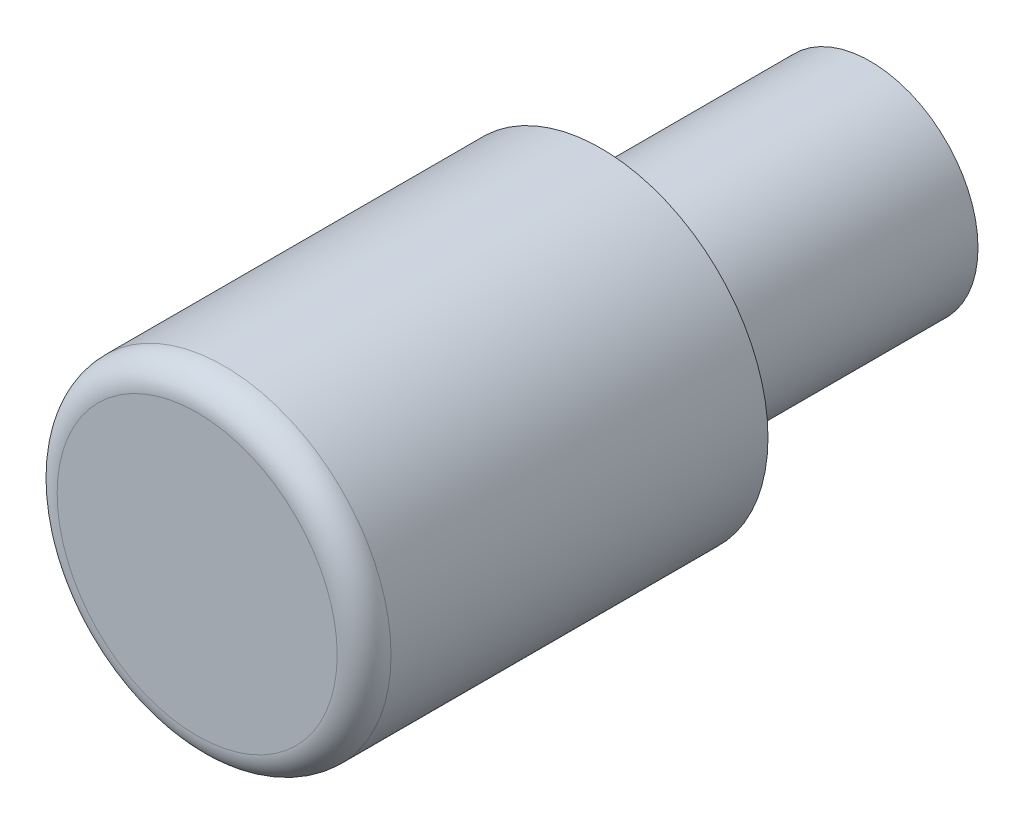
from build123d import *

# Parameters (mm, degrees)
SKETCH1_R           = 1.5748
BOSS_EXTRUDE1_DEPTH = 3.81
SKETCH2_R           = 1.016
BOSS_EXTRUDE2_DEPTH = 2.54
FILLET1_R           = 0.254


with BuildPart() as part:
    # Sketch1 → Boss-Extrude1 (new body)
    with BuildSketch(Plane.XY):
        with Locations(Location((0, 0, 0), (0, 0, 180))):
            Circle(SKETCH1_R)
    extrude(amount=BOSS_EXTRUDE1_DEPTH)

    # Sketch2 → Boss-Extrude2 (add)
    with BuildSketch(Plane(origin=(0, 0, 0), x_dir=(-1, 0, 0), z_dir=(0, 0, -1))):
        with Locations(Location((0, 0, 0), (0, 0, 180))):
            Circle(SKETCH2_R)
    extrude(amount=BOSS_EXTRUDE2_DEPTH)

    # Fillet1
    fillet1_edges = [part.edges().sort_by_distance(p)[0] for p in [
        (1.5748, 0, 3.81),
    ]]
    fillet(fillet1_edges, radius=FILLET1_R)


solid = part.part
